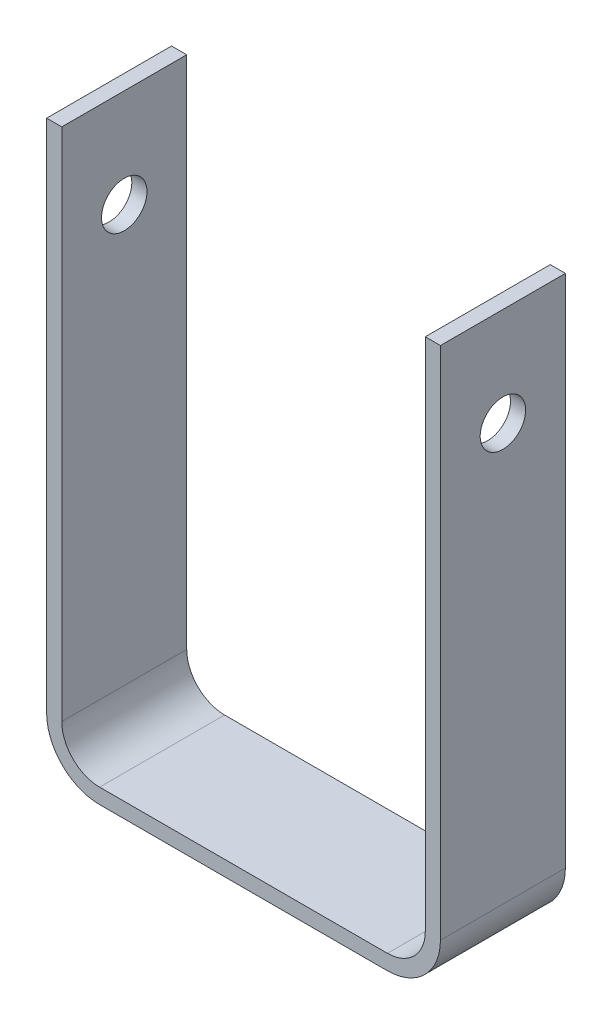
from build123d import *

# Parameters (mm, degrees)
EXTRUDE_1_DEPTH          = 33
CUT_EXTRUDE_1_DEPTH      = 186.485848517
CUT_EXTRUDE_1_DEPTH_BACK = 186.485848517
SKETCH_2_R               = 6


with BuildPart() as part:
    # Эскиз1 → Бобышка-Вытянуть1 (new body)
    with BuildSketch(Plane.XY):
        with BuildLine():
            Line((0, 0), (38, 0))
            ThreePointArc((38, 0), (47.899494937, 4.100505063), (52, 14))
            Line((52, 14), (52, 150))
            Line((52, 150), (48, 150))
            Line((48, 150), (48, 14))
            ThreePointArc((48, 14), (45.071067812, 6.928932188), (38, 4))
            Line((38, 4), (0, 4))
            Line((0, 4), (-38, 4))
            ThreePointArc((-38, 4), (-45.071067812, 6.928932188), (-48, 14))
            Line((-48, 14), (-48, 150))
            Line((-48, 150), (-52, 150))
            Line((-52, 150), (-52, 14))
            ThreePointArc((-52, 14), (-47.899494937, 4.100505063), (-38, 0))
            Line((-38, 0), (0, 0))
        make_face()
    extrude(amount=EXTRUDE_1_DEPTH)

    # Эскиз2 → Вырез-Вытянуть1 (cut, two sides: drawn at the far end of the back side and taken through both)
    with BuildSketch(Plane(origin=(52, 0, 0), x_dir=(0, 0, -1), z_dir=(1, 0, 0)).offset(-CUT_EXTRUDE_1_DEPTH_BACK)):
        with Locations((-16.5, 124)):
            Circle(SKETCH_2_R)
    extrude(amount=CUT_EXTRUDE_1_DEPTH + CUT_EXTRUDE_1_DEPTH_BACK, mode=Mode.SUBTRACT)


solid = part.part
